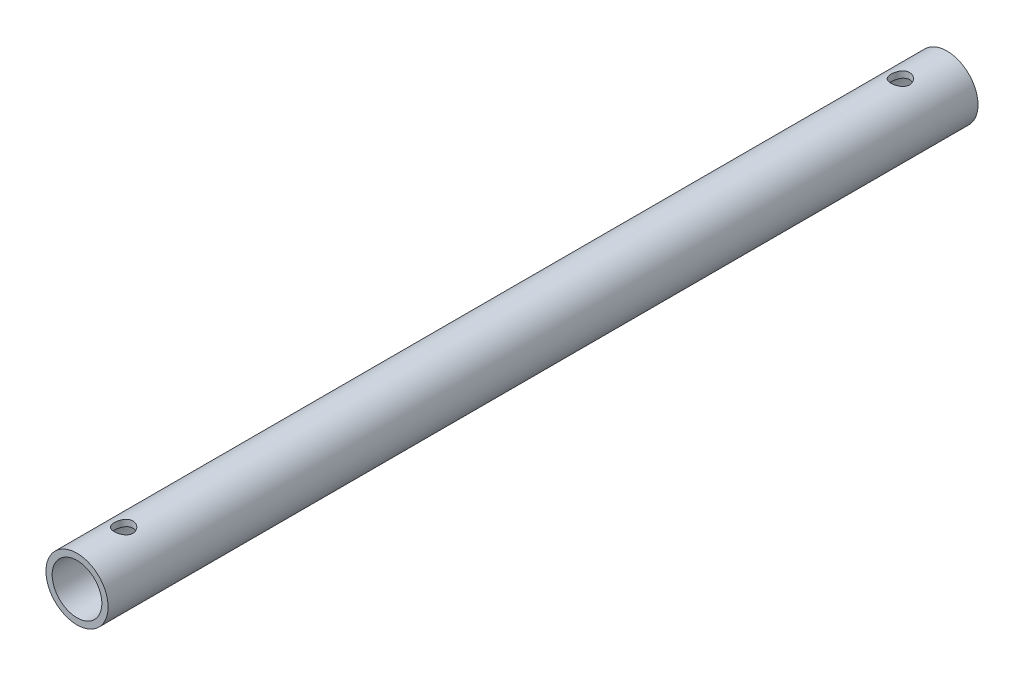
from build123d import *

# Parameters (mm, degrees)
SKETCH1_R               = 5
SKETCH1_R_2             = 4
BOSS_EXTRUDE1_DEPTH     = 140
CUT_EXTRUDE1_DEPTH      = 175
CUT_EXTRUDE1_DEPTH_BACK = 175
SKETCH3_R               = 1.5
CUT_EXTRUDE2_DEPTH      = 10
CUT_EXTRUDE2_DEPTH_BACK = 10
SKETCH4_R               = 1.5


with BuildPart() as part:
    # Sketch1 → Boss-Extrude1 (new body)
    with BuildSketch(Plane.XY):
        Circle(SKETCH1_R)
        Circle(SKETCH1_R_2, mode=Mode.SUBTRACT)
    extrude(amount=BOSS_EXTRUDE1_DEPTH)

    # Sketch3 → Cut-Extrude1 (cut, two sides: drawn at the far end of the back side and taken through both)
    with BuildSketch(Plane(origin=(0, 0, 0), x_dir=(1, 0, 0), z_dir=(0, 1, 0)).offset(-CUT_EXTRUDE1_DEPTH_BACK)):
        with Locations((0, -7.5)):
            Circle(SKETCH3_R)
    extrude(amount=CUT_EXTRUDE1_DEPTH + CUT_EXTRUDE1_DEPTH_BACK, mode=Mode.SUBTRACT)

    # Sketch4 → Cut-Extrude2 (cut, two sides: drawn at the far end of the back side and taken through both)
    with BuildSketch(Plane(origin=(0, 0, 0), x_dir=(1, 0, 0), z_dir=(0, 1, 0)).offset(-CUT_EXTRUDE2_DEPTH_BACK)):
        with Locations((0, -132.5)):
            Circle(SKETCH4_R)
    extrude(amount=CUT_EXTRUDE2_DEPTH + CUT_EXTRUDE2_DEPTH_BACK, mode=Mode.SUBTRACT)


solid = part.part
